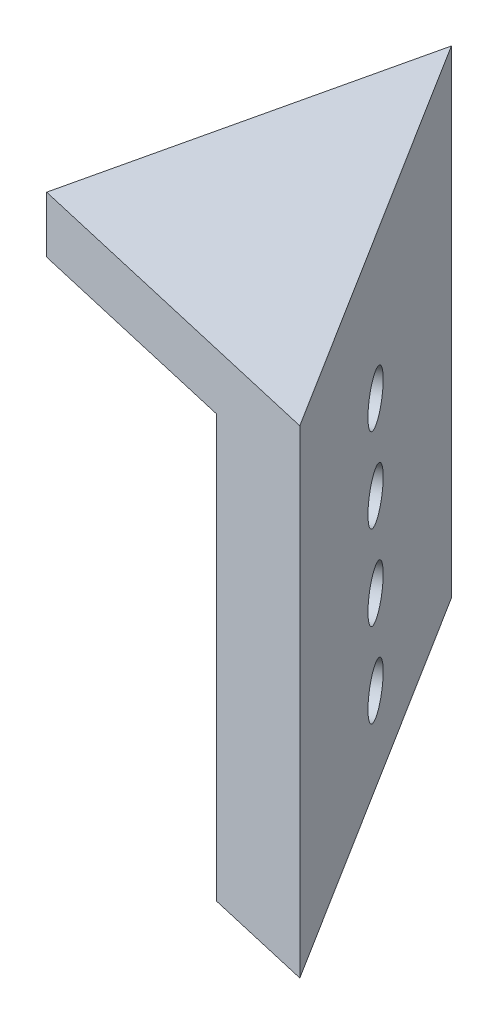
from build123d import *

# Parameters (mm, degrees)
BOSS_EXTRUDE1_DEPTH = 25.4
BOSS_EXTRUDE2_DEPTH = 215.9
SKETCH3_R           = 10.795
CUT_EXTRUDE1_DEPTH  = 381


with BuildPart() as part:
    # Sketch1 → Boss-Extrude1 (new body)
    with BuildSketch(Plane(origin=(0, 0, 0), x_dir=(1, 0, 0), z_dir=(0, 1, 0))):
        Polygon((0, 0), (148.510590519, -34.210590519), (34.210590519, 148.510590519), align=None)
    extrude(amount=BOSS_EXTRUDE1_DEPTH)

    # Sketch2 → Boss-Extrude2 (add)
    with BuildSketch(Plane(origin=(0, 25.4, 0), x_dir=(1, 0, 0), z_dir=(0, 1, 0))):
        Polygon((34.210590519, 148.510590519), (22.983547144, 99.773202004), (99.773202004, -22.983547144), (148.510590519, -34.210590519), align=None)
    extrude(amount=-BOSS_EXTRUDE2_DEPTH)

    # Sketch3 → Cut-Extrude1 (cut)
    with BuildSketch(Plane(origin=(61.378374574, 0, -38.39482743), x_dir=(0.5303300858898913, 0, 0.8477912478906706), z_dir=(-0.8477912478906706, 0, 0.5303300858898913))):
        with Locations((0, -38.1)):
            Circle(SKETCH3_R)
        with Locations((0, -114.3)):
            Circle(SKETCH3_R)
        with Locations((0, -152.4)):
            Circle(SKETCH3_R)
        with Locations((0, -76.2)):
            Circle(SKETCH3_R)
    extrude(amount=-CUT_EXTRUDE1_DEPTH, mode=Mode.SUBTRACT)


solid = part.part
